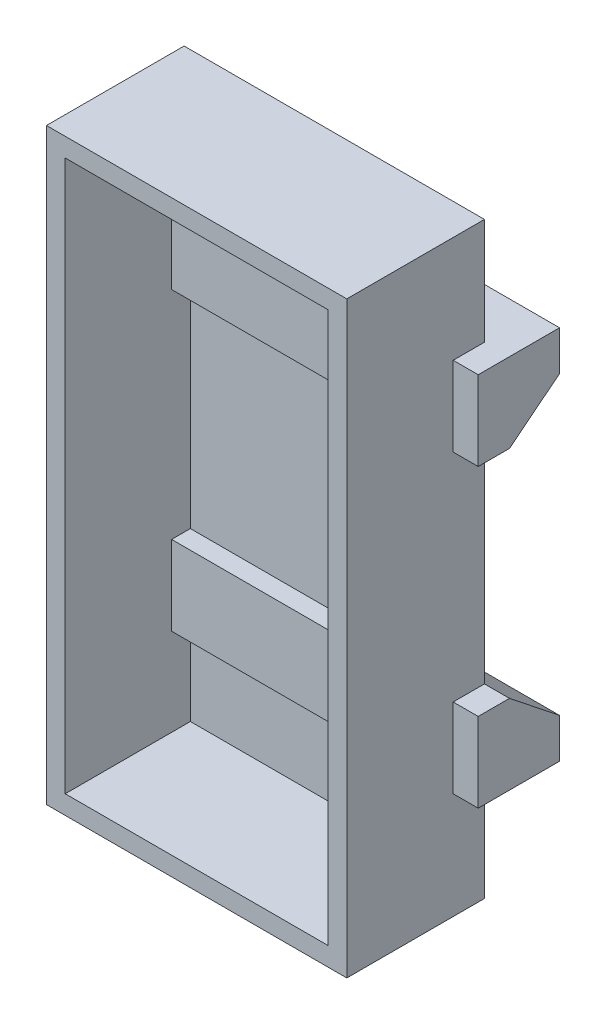
from build123d import *

# Parameters (mm, degrees)
SKETCH_1_W          = 24
SKETCH_1_H          = 47
EXTRUDE_1_DEPTH     = 11
SKETCH_2_W          = 21
SKETCH_2_H          = 44
CUT_EXTRUDE_1_DEPTH = 10
SKETCH_3_W          = 6.5
SKETCH_3_H          = 6.352849337
EXTRUDE_2_DEPTH     = 26
SKETCH_4_W          = 7
SKETCH_4_H          = 6.352849337
EXTRUDE_3_DEPTH     = 2
CUT_EXTRUDE_2_DEPTH = 35


with BuildPart() as part:
    # 草图1 → 凸台-拉伸1 (new body)
    with BuildSketch(Plane.XY):
        with Locations((-12.862884841, -44.211686375)):
            Rectangle(SKETCH_1_W, SKETCH_1_H)
    extrude(amount=EXTRUDE_1_DEPTH)

    # 草图2 → 切除-拉伸1 (cut)
    with BuildSketch(Plane.XY.offset(11)):
        with Locations((-12.862884841, -44.211686375)):
            Rectangle(SKETCH_2_W, SKETCH_2_H)
    extrude(amount=-CUT_EXTRUDE_1_DEPTH, mode=Mode.SUBTRACT)

    # 草图3 → 凸台-拉伸2 (add)
    with BuildSketch(Plane.ZY.offset(24.862884841)):
        with Locations((-0.75, -32.388111044)):
            Rectangle(SKETCH_3_W, SKETCH_3_H)
        with Locations((-0.75, -56.035261707)):
            Rectangle(SKETCH_3_W, SKETCH_3_H)
    extrude(amount=-EXTRUDE_2_DEPTH)

    # 草图4 → 凸台-拉伸3 (add)
    with BuildSketch(Plane.ZY.offset(24.862884841)):
        with Locations((-0.5, -32.388111044)):
            Rectangle(SKETCH_4_W, SKETCH_4_H)
        with Locations((-0.5, -56.035261707)):
            Rectangle(SKETCH_4_W, SKETCH_4_H)
    extrude(amount=EXTRUDE_3_DEPTH)

    # 草图6 → 切除-拉伸2 (cut)
    with BuildSketch(Plane.ZY.offset(26.862884841)):
        Polygon((0, -35.564535712), (-4, -32.388111043), (-4, -35.564535712), align=None)
        Polygon((0, -52.858837038), (-4, -56.035261706), (-4, -52.858837038), align=None)
    extrude(amount=-CUT_EXTRUDE_2_DEPTH, mode=Mode.SUBTRACT)


solid = part.part
